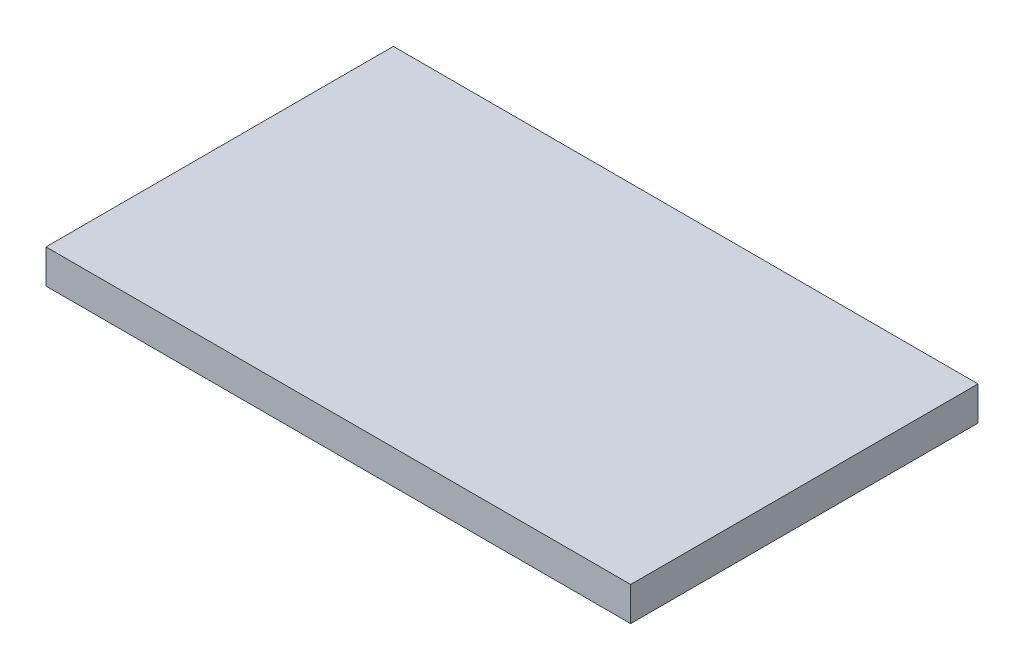
from build123d import *

# Parameters (mm, degrees)
SKETCH1_W                = 1275
SKETCH1_H                = 74
STORE_AYIRICI_PU_1_DEPTH = 757.5


with BuildPart() as part:
    # Sketch1 → STORE_ayirici_pu_1 (new body)
    with BuildSketch(Plane.XY):
        with Locations((700, 728)):
            Rectangle(SKETCH1_W, SKETCH1_H)
    extrude(amount=-STORE_AYIRICI_PU_1_DEPTH)


solid = part.part
